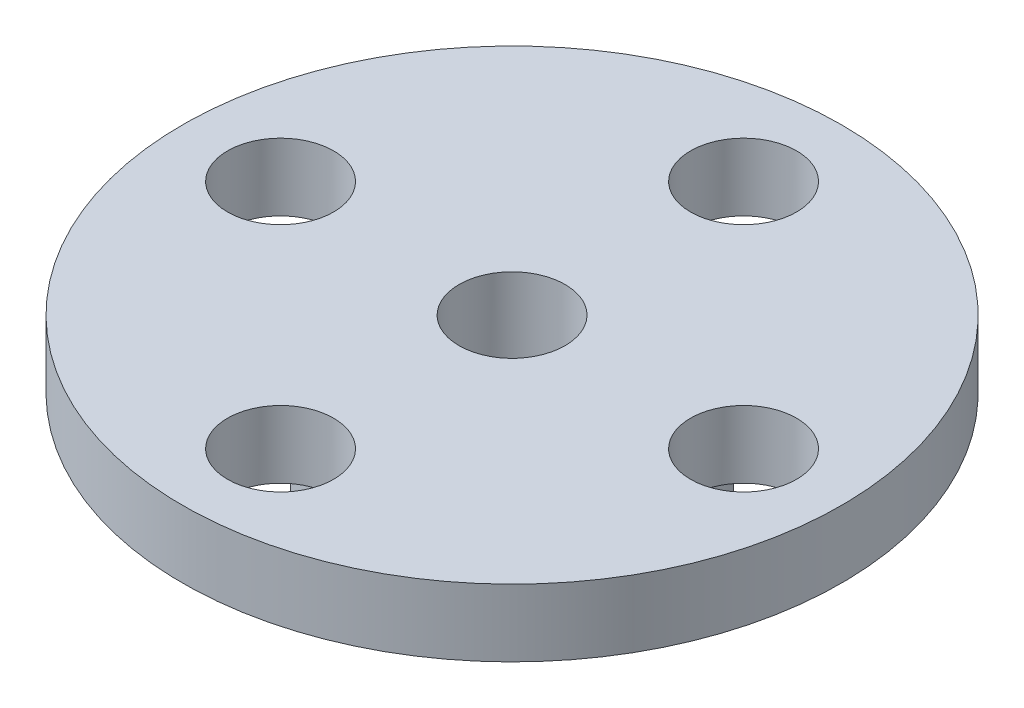
from build123d import *

# Parameters (mm, degrees)
SKETCH4_R            = 2.667
CUT_EXTRUDE2_DEPTH   = 2.921
M3_CLEARANCE_HOLE1_D = 3.2


with BuildPart() as part:
    # Sketch1 → Revolve1 (revolve)
    with BuildSketch(Plane(origin=(0, 0, 0), x_dir=(0, 0, -1), z_dir=(1, 0, 0))):
        Polygon((0, 5.3848), (9.9441, 5.3848), (9.9441, 3.3528), (4.7244, 3.3528), (4.7244, 0), (0, 0), align=None)
    revolve(axis=Axis((0, 0, 0), (0, 1, 0)))

    # Sketch4 → Cut-Extrude2 (cut)
    with BuildSketch(Plane.XZ):
        with Locations(Location((0, 0, 0), (0, 0, 270))):
            Circle(SKETCH4_R)
    extrude(amount=-CUT_EXTRUDE2_DEPTH, mode=Mode.SUBTRACT)

    # M3 Clearance Hole1 (through all)
    with Locations(Plane(origin=(0, 5.3848, 0), x_dir=(1, 0, 0), z_dir=(0, 1, 0))):
        with Locations((-6.985, 0), (0, 0), (6.985, 0), (0, 6.985), (0, -6.985)):
            Hole(M3_CLEARANCE_HOLE1_D / 2)


solid = part.part
